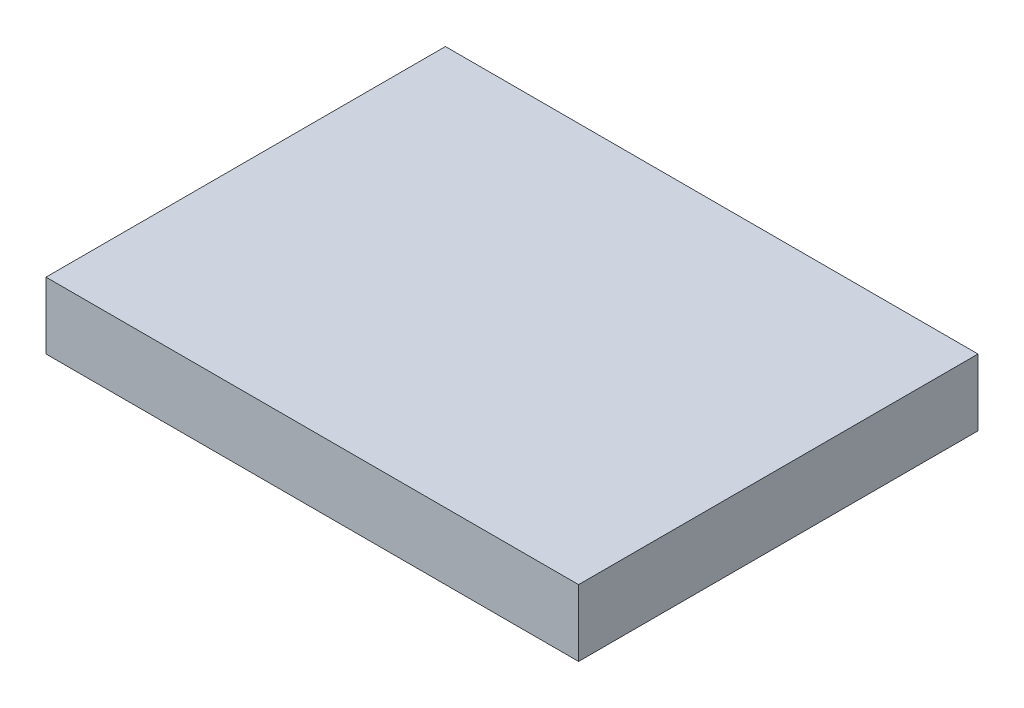
from build123d import *

# Parameters (mm, degrees)
SKETCH14_W     = 101.6
SKETCH14_H     = 76.2
EXTRUDE6_DEPTH = 12.7


with BuildPart() as part:
    # Sketch14 → Extrude6 (new body)
    with BuildSketch(Plane(origin=(0, 0, 0), x_dir=(1, 0, 0), z_dir=(0, 1, 0))):
        with Locations((50.8, 38.1)):
            Rectangle(SKETCH14_W, SKETCH14_H)
    extrude(amount=-EXTRUDE6_DEPTH)


solid = part.part
